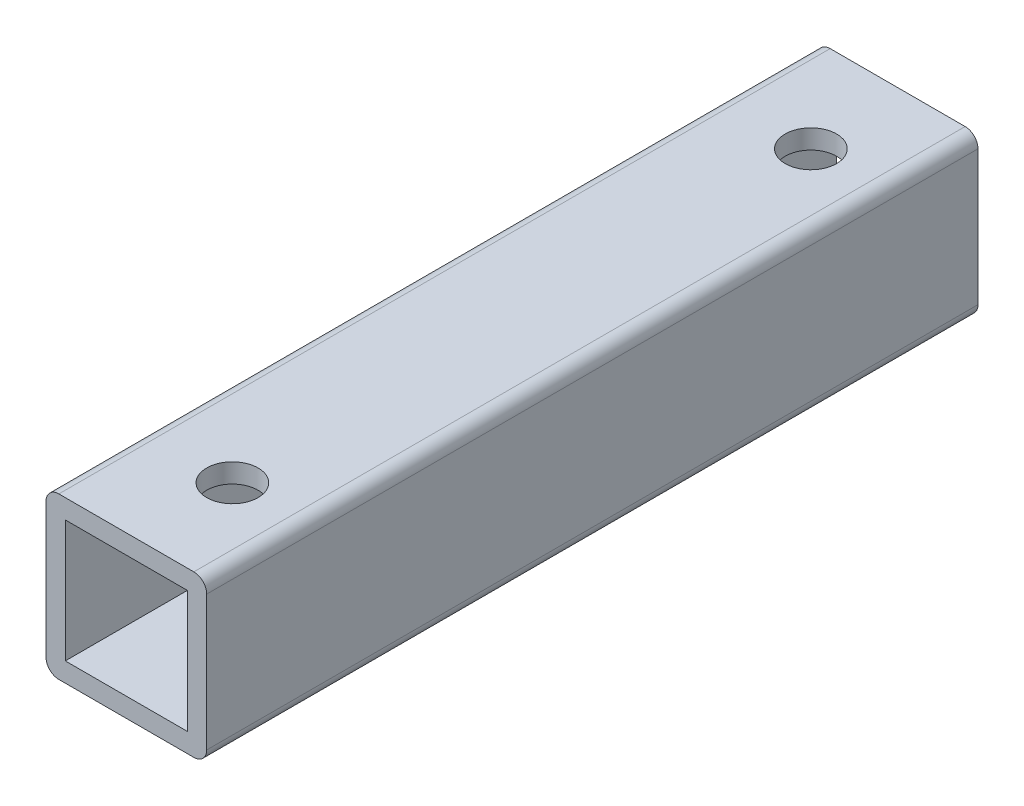
from build123d import *

# Parameters (mm, degrees)
EXTRUDE_THIN1_DEPTH      = 60
EXTRUDE_THIN1_DEPTH_BACK = 60
SKETCH1_W                = 25
SKETCH1_H                = 25
SKETCH1_W_2              = 19
SKETCH1_H_2              = 19
FILLET1_R                = 2
SKETCH3_R                = 4
CUT_EXTRUDE2_DEPTH       = 67.191011474


with BuildPart() as part:
    # Sketch1 → Extrude-Thin1 (new, two sides: drawn at the far end of the back side and taken through both)
    with BuildSketch(Plane.XY.offset(-EXTRUDE_THIN1_DEPTH_BACK)):
        Rectangle(SKETCH1_W, SKETCH1_H)
        Rectangle(SKETCH1_W_2, SKETCH1_H_2, mode=Mode.SUBTRACT)
    extrude(amount=EXTRUDE_THIN1_DEPTH + EXTRUDE_THIN1_DEPTH_BACK)

    # Fillet1
    fillet1_edges = [part.edges().sort_by_distance(p)[0] for p in [
        (12.5, -12.5, 0),
        (-12.5, -12.5, 0),
        (-12.5, 12.5, 0),
        (12.5, 12.5, 0),
    ]]
    fillet(fillet1_edges, radius=FILLET1_R)

    # Sketch3 → Cut-Extrude2 (cut, through all)
    with BuildSketch(Plane(origin=(0, 12.5, 0), x_dir=(1, 0, 0), z_dir=(0, 1, 0))):
        with Locations(Location((1.5, -45, 0), (0, 0, 270))):
            Circle(SKETCH3_R)
        with Locations(Location((1.5, 45, 0), (0, 0, 270))):
            Circle(SKETCH3_R)
    extrude(amount=-CUT_EXTRUDE2_DEPTH, mode=Mode.SUBTRACT)


solid = part.part
